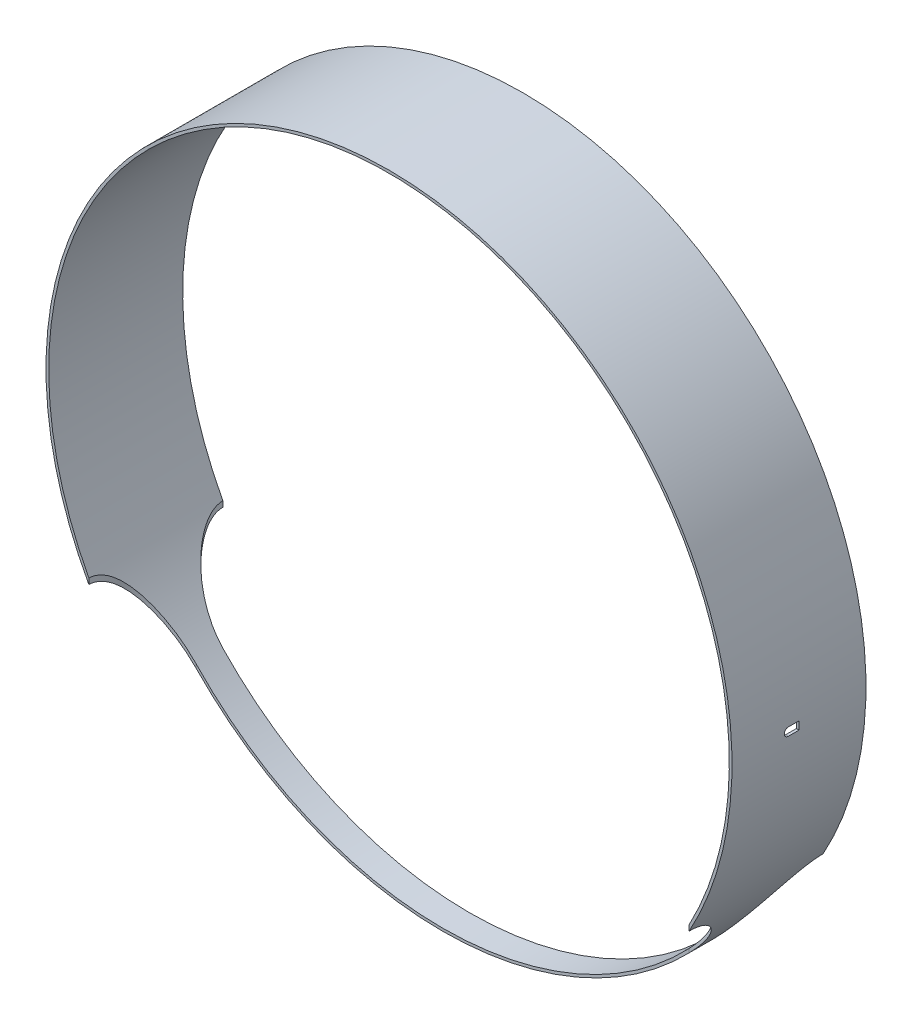
from build123d import *

# Parameters (mm, degrees)
SKETCH_3_R          = 64
SKETCH_3_R_2        = 63.5
EXTRUDE_2_DEPTH     = 25
CUT_EXTRUDE_2_DEPTH = 200
CUT_EXTRUDE_3_DEPTH = 200


with BuildPart() as part:
    # 草图3 → 凸台-拉伸2 (new body)
    with BuildSketch(Plane.XY):
        Circle(SKETCH_3_R)
        Circle(SKETCH_3_R_2, mode=Mode.SUBTRACT)
    extrude(amount=EXTRUDE_2_DEPTH)

    # 草图4 → 切除-拉伸2 (cut)
    with BuildSketch(Plane(origin=(0, 0, 0), x_dir=(1, 0, 0), z_dir=(0, 1, 0))):
        with BuildLine():
            Line((-46, -10), (46, -10))
            ThreePointArc((46, -10), (53.071067812, -7.071067812), (56, 0))
            Line((56, 0), (-56, 0))
            ThreePointArc((-56, 0), (-53.071067812, -7.071067812), (-46, -10))
        make_face()
        with BuildLine():
            Line((-46, -15), (46, -15))
            ThreePointArc((46, -15), (53.071067812, -17.928932188), (56, -25))
            Line((56, -25), (-56, -25))
            ThreePointArc((-56, -25), (-53.071067812, -17.928932188), (-46, -15))
        make_face()
    extrude(amount=-CUT_EXTRUDE_2_DEPTH, mode=Mode.SUBTRACT)

    # 草图6 → 切除-拉伸3 (cut)
    with BuildSketch(Plane(origin=(0, 0, 0), x_dir=(0, 0, -1), z_dir=(1, 0, 0))):
        with BuildLine():
            Line((-12.5, -0.75), (-12.5, 0.75))
            Line((-12.5, 0.75), (-14.5, 0.75))
            ThreePointArc((-14.5, 0.75), (-15.25, 0), (-14.5, -0.75))
            Line((-14.5, -0.75), (-12.5, -0.75))
        make_face()
    extrude(amount=CUT_EXTRUDE_3_DEPTH, mode=Mode.SUBTRACT)


solid = part.part
